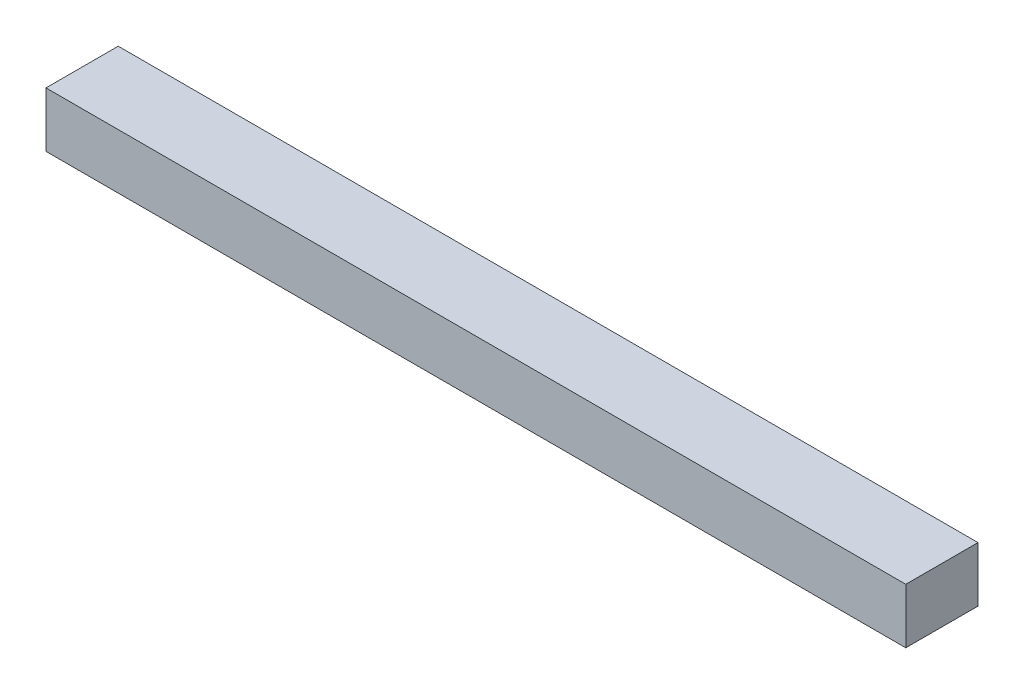
from build123d import *

# Parameters (mm, degrees)
SKETCH_1_W        = 2500
SKETCH_1_H        = 160
EXTRUDE_217_DEPTH = 210


with BuildPart() as part:
    # 草图1 → Extrude 217 (new body)
    with BuildSketch(Plane.XY):
        with Locations((1164.948484848, 59.718484848)):
            Rectangle(SKETCH_1_W, SKETCH_1_H)
    extrude(amount=EXTRUDE_217_DEPTH)


solid = part.part
